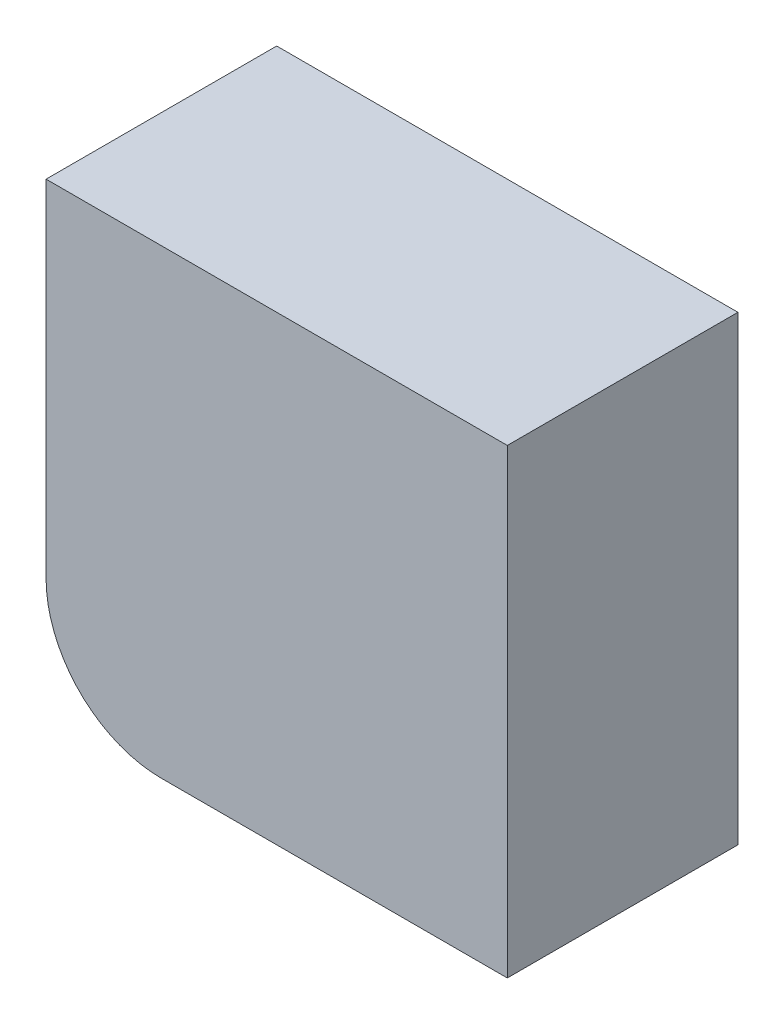
from build123d import *

# Parameters (mm, degrees)
SKETCH_1_W    = 20
SKETCH_1_H    = 20
BASEBOX_DEPTH = 10
FACEFILLET_R  = 5


with BuildPart() as part:
    # 草图1 → BaseBox (new body)
    with BuildSketch(Plane.XY):
        with Locations((10, 10)):
            Rectangle(SKETCH_1_W, SKETCH_1_H)
    extrude(amount=BASEBOX_DEPTH)

    # FaceFillet
    facefillet_edges = [part.edges().sort_by_distance(p)[0] for p in [
        (0, 0, 5),
    ]]
    fillet(facefillet_edges, radius=FACEFILLET_R)


solid = part.part
